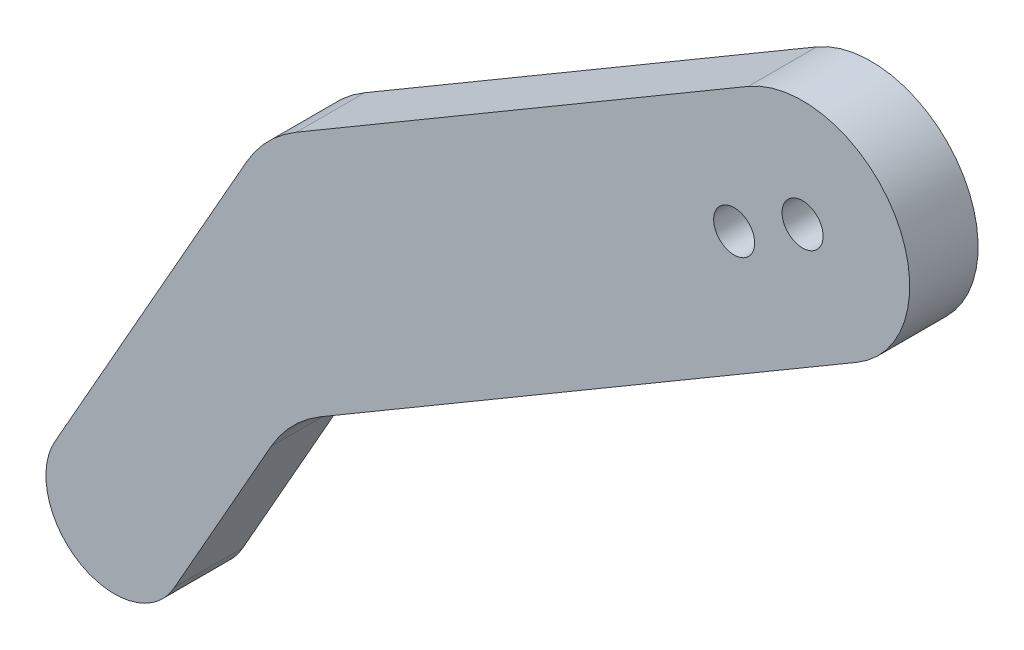
from build123d import *

# Parameters (mm, degrees)
BOSS_EXTRUDE1_DEPTH = 5
SKETCH4_R           = 1.5
CUT_EXTRUDE1_DEPTH  = 7


with BuildPart() as part:
    # Sketch3 → Boss-Extrude1 (new body)
    with BuildSketch(Plane.XY):
        with BuildLine():
            Line((0, 0), (13.967571819, 24.636519948))
            ThreePointArc((13.967571819, 24.636519948), (15.54047533, 26.719980839), (17.599022813, 28.325352137))
            Line((17.599022813, 28.325352137), (50.634350714, 47.745147441))
            ThreePointArc((50.634350714, 47.745147441), (61.352639644, 44.963050987), (58.570543189, 34.244762057))
            Line((58.570543189, 34.244762057), (19.393453686, 11.214536322))
            ThreePointArc((19.393453686, 11.214536322), (17.334906203, 9.609165025), (15.762002691, 7.525704134))
            Line((15.762002691, 7.525704134), (8.699180072, -4.931963714))
            ThreePointArc((8.699180072, -4.931963714), (1.838948591, -6.894344126), (0, 0))
        make_face()
    extrude(amount=BOSS_EXTRUDE1_DEPTH)

    # Sketch4 → Cut-Extrude1 (cut)
    with BuildSketch(Plane.XY.offset(5)):
        with Locations((54.602446951, 40.994954749)):
            Circle(SKETCH4_R)
        with Locations((49.602446951, 38.055708109)):
            Circle(SKETCH4_R)
    extrude(amount=-CUT_EXTRUDE1_DEPTH, mode=Mode.SUBTRACT)


solid = part.part
